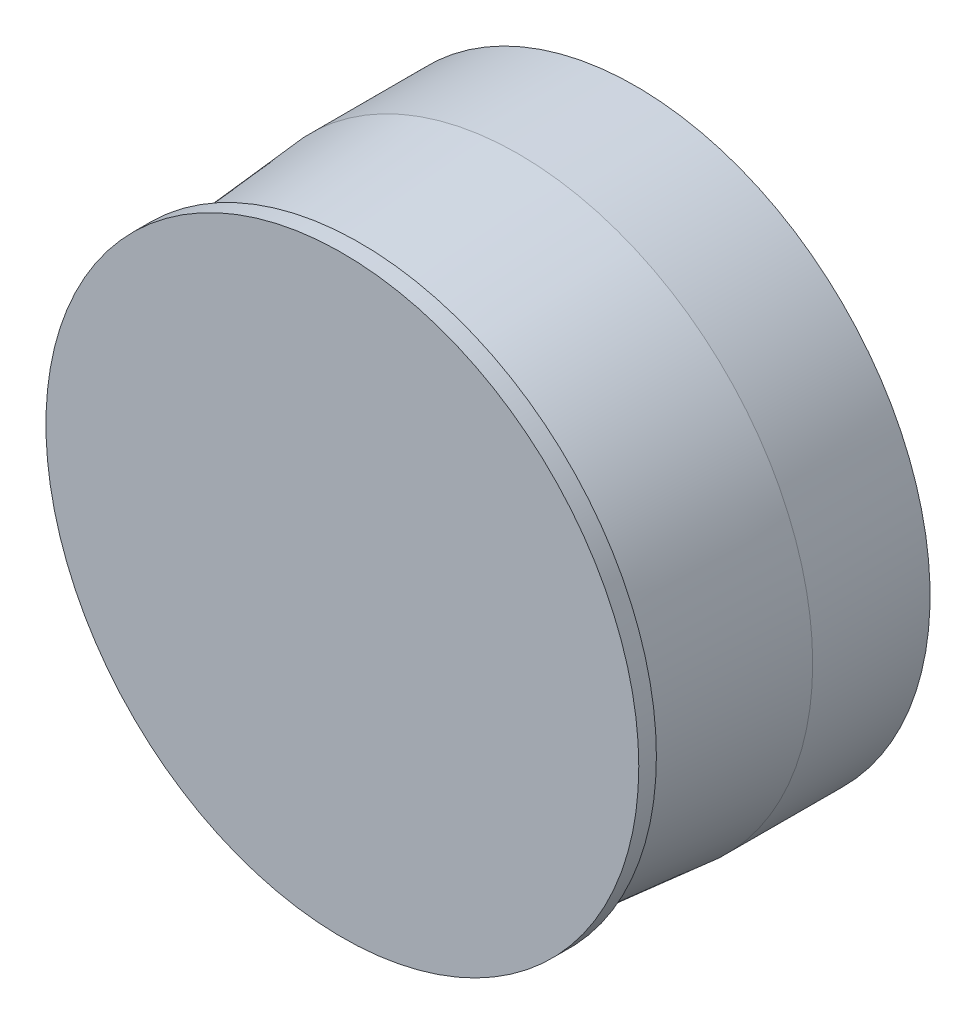
from build123d import *

# Parameters (mm, degrees)
SKETCH1_R           = 47.5
BOSS_EXTRUDE1_DEPTH = 30
BOSS_EXTRUDE1_DRAFT = 5
SKETCH1_3_R         = 50.5
BOSS_EXTRUDE2_DEPTH = 3
SKETCH2_R           = 50.124659906
BOSS_EXTRUDE3_DEPTH = 20


with BuildPart() as part:
    # Sketch1 → Boss-Extrude1 (with draft: the straight prism first)
    with BuildSketch(Plane.XY):
        Circle(SKETCH1_R)
    extrude(amount=-BOSS_EXTRUDE1_DEPTH)
    # Boss-Extrude1: the draft: its side faces are tilted about the plane it starts from
    boss_extrude1_sides = [part.faces().sort_by_distance(p)[0] for p in [
        (-47.5, 0, -15),
    ]]
    draft(boss_extrude1_sides, Plane.XY, BOSS_EXTRUDE1_DRAFT)

    # Sketch1<3> → Boss-Extrude2 (add)
    with BuildSketch(Plane.XY):
        Circle(SKETCH1_3_R)
    extrude(amount=-BOSS_EXTRUDE2_DEPTH)

    # Sketch2 → Boss-Extrude3 (add)
    with BuildSketch(Plane(origin=(0, 0, -30), x_dir=(-1, 0, 0), z_dir=(0, 0, -1))):
        Circle(SKETCH2_R)
    extrude(amount=BOSS_EXTRUDE3_DEPTH)


solid = part.part
